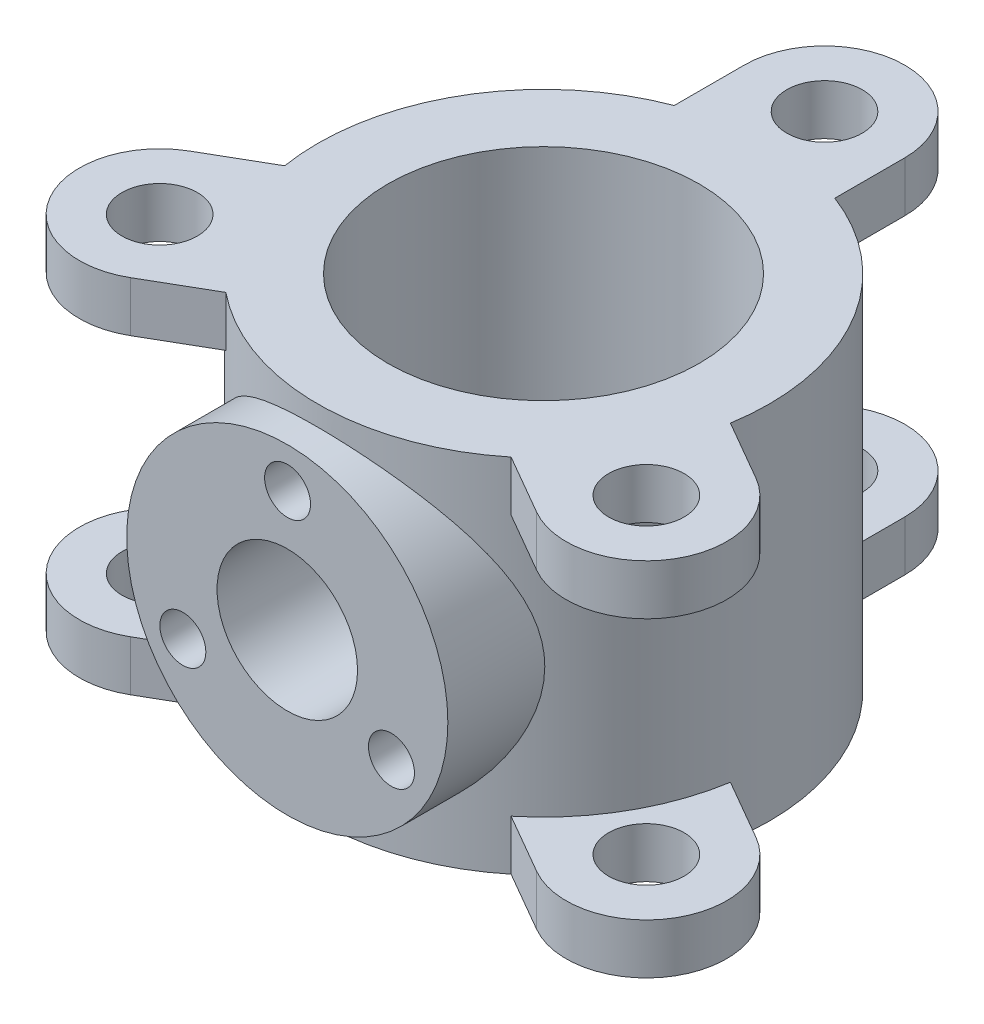
from build123d import *

# Parameters (mm, degrees)
SKETCH1_R               = 35.7124
SKETCH1_R_2             = 24.6126
BOSS_EXTRUDE1_DEPTH     = 57.15
SKETCH2_R               = 5.969
BOSS_EXTRUDE2_DEPTH     = 7.9502
CIRPATTERN1_COUNT       = 3
MIRROR1_COPY_1_SKETCH_R = 5.969
MIRROR1_COPY_1_DEPTH    = 7.9502
MIRROR1_COPY_2_SKETCH_R = 5.969
MIRROR1_COPY_2_DEPTH    = 7.9502
SKETCH3_R               = 25.4
BOSS_EXTRUDE3_DEPTH     = 19.05
CUT_EXTRUDE1_START      = -57.15
SKETCH4_R               = 24.6126
CUT_EXTRUDE1_DEPTH      = 57.15
SKETCH6_R               = 11.1125
CUT_EXTRUDE2_DEPTH      = 57.15
SKETCH7_R               = 3.636030774
CUT_EXTRUDE3_DEPTH      = 9.525


with BuildPart() as part:
    # Sketch1 → Boss-Extrude1 (new body)
    with BuildSketch(Plane(origin=(0, 0, 0), x_dir=(1, 0, 0), z_dir=(0, 1, 0))):
        with Locations(Location((0, 0, 0), (0, 0, 270))):
            Circle(SKETCH1_R)
        with Locations(Location((0, 0, 0), (0, 0, 270))):
            Circle(SKETCH1_R_2, mode=Mode.SUBTRACT)
    extrude(amount=BOSS_EXTRUDE1_DEPTH)

    # Sketch2 → Boss-Extrude2 (add)
    with BuildSketch(Plane(origin=(0, 57.15, 0), x_dir=(1, 0, 0), z_dir=(0, 1, 0))):
        with BuildLine():
            Line((-12.7, 44.45), (-12.7, 33.377919554))
            Line((-12.7, 33.377919554), (12.7, 33.377919554))
            Line((12.7, 33.377919554), (12.7, 44.45))
            ThreePointArc((12.7, 44.45), (0, 57.15), (-12.7, 44.45))
        make_face()
        with Locations(Location((0, 44.45, 0), (0, 0, 270))):
            Circle(SKETCH2_R, mode=Mode.SUBTRACT)
    boss_extrude2 = extrude(amount=-BOSS_EXTRUDE2_DEPTH)

    # CirPattern1: Boss-Extrude2 ×3 about axis
    cirpattern1_axis = Axis((0, 0, 0), (0, 1, 0))
    for i in range(1, CIRPATTERN1_COUNT):
        add(boss_extrude2.rotate(cirpattern1_axis, i * 360 / CIRPATTERN1_COUNT))

    # Mirror1: Boss-Extrude2 across plane
    add(boss_extrude2.mirror(Plane.ZX.offset(28.575)))

    # Mirror1 copy 1 sketch → Mirror1 copy 1 (add)
    with BuildSketch(Plane(origin=(0, 0, 0), x_dir=(-0.4999999999999998, 0, -0.8660254037844387), z_dir=(0, -1, 0))):
        with BuildLine():
            Line((-12.7, -44.45), (-12.7, -33.377919554))
            Line((-12.7, -33.377919554), (12.7, -33.377919554))
            Line((12.7, -33.377919554), (12.7, -44.45))
            ThreePointArc((12.7, -44.45), (0, -57.15), (-12.7, -44.45))
        make_face()
        with Locations((0, -44.45)):
            Circle(MIRROR1_COPY_1_SKETCH_R, mode=Mode.SUBTRACT)
    extrude(amount=-MIRROR1_COPY_1_DEPTH)

    # Mirror1 copy 2 sketch → Mirror1 copy 2 (add)
    with BuildSketch(Plane(origin=(0, 0, 0), x_dir=(-0.5000000000000004, 0, 0.8660254037844384), z_dir=(0, -1, 0))):
        with BuildLine():
            Line((-12.7, -44.45), (-12.7, -33.377919554))
            Line((-12.7, -33.377919554), (12.7, -33.377919554))
            Line((12.7, -33.377919554), (12.7, -44.45))
            ThreePointArc((12.7, -44.45), (0, -57.15), (-12.7, -44.45))
        make_face()
        with Locations((0, -44.45)):
            Circle(MIRROR1_COPY_2_SKETCH_R, mode=Mode.SUBTRACT)
    extrude(amount=-MIRROR1_COPY_2_DEPTH)

    # Sketch3 → Boss-Extrude3 (add)
    with BuildSketch(Plane.XY.offset(40.4876)):
        with Locations((-0.044379285, 28.575)):
            Circle(SKETCH3_R)
    extrude(amount=-BOSS_EXTRUDE3_DEPTH)

    # Sketch4 → Cut-Extrude1 (cut)
    with BuildSketch(Plane(origin=(0, 57.15, 0), x_dir=(1, 0, 0), z_dir=(0, 1, 0)).offset(CUT_EXTRUDE1_START)):
        with Locations(Location((0, 0, 0), (0, 0, 270))):
            Circle(SKETCH4_R)
    extrude(amount=CUT_EXTRUDE1_DEPTH, mode=Mode.SUBTRACT)

    # Sketch6 → Cut-Extrude2 (cut)
    with BuildSketch(Plane.XY.offset(40.4876)):
        with Locations((-0.044379285, 28.575)):
            Circle(SKETCH6_R)
    extrude(amount=-CUT_EXTRUDE2_DEPTH, mode=Mode.SUBTRACT)

    # Sketch7 → Cut-Extrude3 (cut)
    with BuildSketch(Plane.XY.offset(40.4876)):
        with Locations((0, 47.625)):
            Circle(SKETCH7_R)
        with Locations((16.431215014, 19.011566412)):
            Circle(SKETCH7_R)
        with Locations((-16.56435287, 19.088433588)):
            Circle(SKETCH7_R)
    extrude(amount=-CUT_EXTRUDE3_DEPTH, mode=Mode.SUBTRACT)


solid = part.part
